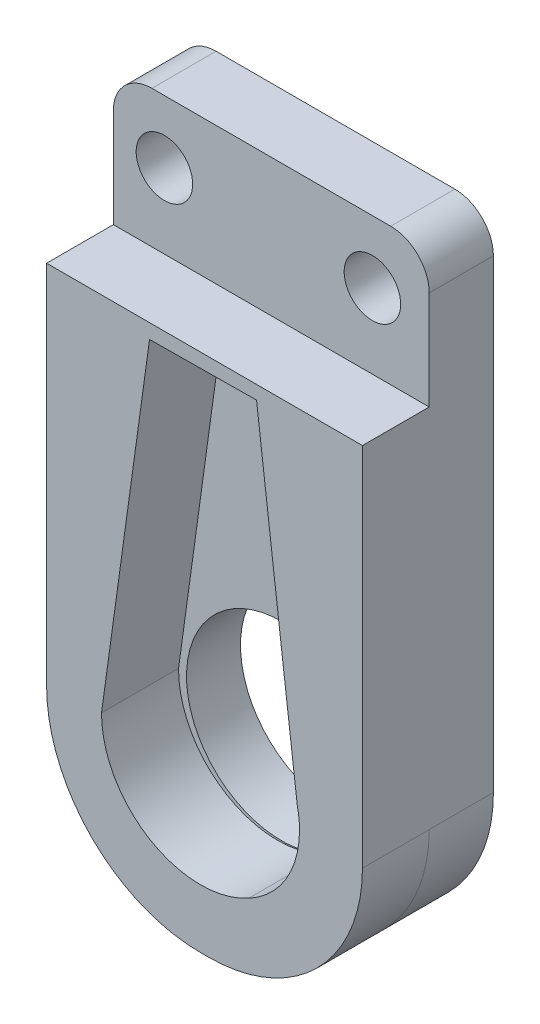
from build123d import *

# Parameters (mm, degrees)
BOSS_EXTRUDE1_DEPTH = 2.5
FILLET1_R           = 6
FILLET2_R           = 1.5
SKETCH3_R           = 1.0999999999999897
CUT_EXTRUDE1_DEPTH  = 3.5
SKETCH4_W           = 12.299999999999898
SKETCH4_H           = 20.25175916550927
BOSS_EXTRUDE2_DEPTH = 2.6
FILLET3_R           = 6
SKETCH5_R           = 3.7000000000000113
CUT_EXTRUDE2_DEPTH  = 406.0937861882827
CUT_EXTRUDE3_DEPTH  = 3


with BuildPart() as part:
    # Sketch2 → Boss-Extrude1 (new body)
    with BuildSketch(Plane.XY.offset(10)):
        Polygon((-326.0372348081085, 240.3636560028167), (-313.73723480810855, 240.3636560028167), (-313.7372348081086, 214.7636560028167), (-326.0372348081085, 214.7636560028167), align=None)
    extrude(amount=BOSS_EXTRUDE1_DEPTH)

    # Fillet1
    fillet1_edges = [part.edges().sort_by_distance(p)[0] for p in [
        (-313.7372348081086, 214.7636560028167, 11.25),
        (-326.0372348081085, 214.7636560028167, 11.25),
    ]]
    fillet(fillet1_edges, radius=FILLET1_R)

    # Fillet2
    fillet2_edges = [part.edges().sort_by_distance(p)[0] for p in [
        (-326.0372348081085, 240.3636560028167, 11.25),
        (-313.73723480810855, 240.3636560028167, 11.25),
    ]]
    fillet(fillet2_edges, radius=FILLET2_R)

    # Sketch3 → Cut-Extrude1 (cut)
    with BuildSketch(Plane.XY.offset(12.5)):
        with Locations((-324.0490905957561, 237.92231401546465)):
            Circle(SKETCH3_R)
        with Locations((-315.94909059575616, 237.92231401546465)):
            Circle(SKETCH3_R)
    extrude(amount=-CUT_EXTRUDE1_DEPTH, mode=Mode.SUBTRACT)

    # Sketch4 → Boss-Extrude2 (add)
    with BuildSketch(Plane.XY.offset(12.5)):
        with Locations((-319.8872348081086, 224.88953558557134)):
            Rectangle(SKETCH4_W, SKETCH4_H)
    extrude(amount=BOSS_EXTRUDE2_DEPTH)

    # Fillet3
    fillet3_edges = [part.edges().sort_by_distance(p)[0] for p in [
        (-313.7372348081086, 214.7636560028167, 13.8),
        (-326.0372348081085, 214.7636560028167, 13.8),
    ]]
    fillet(fillet3_edges, radius=FILLET3_R)

    # Sketch5 → Cut-Extrude2 (cut, through all)
    with BuildSketch(Plane.XY.offset(15.100000000000001)):
        with Locations((-319.88723480810853, 220.81205289784253)):
            Circle(SKETCH5_R)
    extrude(amount=-CUT_EXTRUDE2_DEPTH, mode=Mode.SUBTRACT)

    # Sketch6 → Cut-Extrude3 (cut)
    with BuildSketch(Plane.XY.offset(15.100000000000001)):
        with BuildLine():
            Line((-322.02823852882625, 234.448742964222), (-317.861572265625, 234.4860076904297))
            Line((-317.861572265625, 234.4860076904297), (-316.1885469617624, 220.91058317385776))
            ThreePointArc((-316.1885469617624, 220.91058317385776), (-320.04724170804894, 217.04825103409732), (-323.8989513546933, 220.91754909715644))
            Line((-323.8989513546933, 220.91754909715644), (-322.02823852882625, 234.448742964222))
        make_face()
    extrude(amount=-CUT_EXTRUDE3_DEPTH, mode=Mode.SUBTRACT)


solid = part.part
